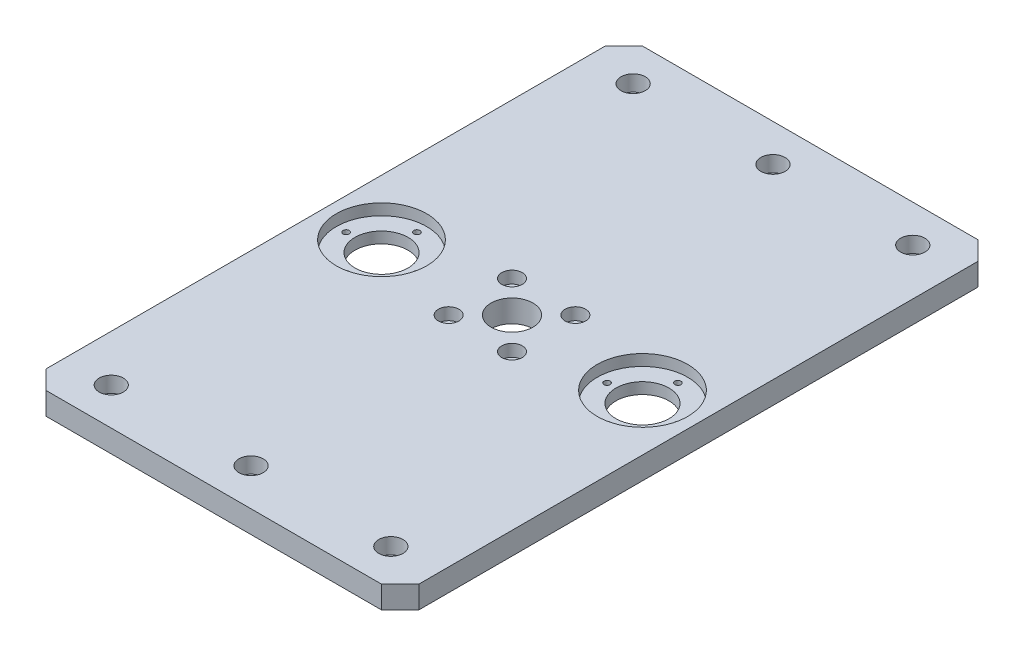
from build123d import *

# Parameters (mm, degrees)
SKETCH_1_W                  = 200
SKETCH_1_H                  = 320
EXTRUDE_1_DEPTH             = 12
HOLE_WIZARD_2_D             = 8.5
HOLE_WIZARD_2_CBORE_D       = 13
HOLE_WIZARD_2_CBORE_DEPTH   = 8.5
CHAMFER_1_SIZE              = 10
SKETCH_4_R                  = 11.25
CUT_EXTRUDE_1_DEPTH         = 190.06083677
HOLE_WIZARD_2_2_D           = 6.5
HOLE_WIZARD_2_2_CBORE_D     = 11
HOLE_WIZARD_2_2_CBORE_DEPTH = 6.5
SKETCH_7_R                  = 24.25
CUT_EXTRUDE_2_DEPTH         = 6
SKETCH_8_R                  = 14.25
CUT_EXTRUDE_3_DEPTH         = 189.774998345
HOLE_WIZARD_M4_1_D          = 3.3


with BuildPart() as part:
    # 草图1 → 凸台-拉伸1 (new body)
    with BuildSketch(Plane(origin=(0, 0, 0), x_dir=(1, 0, 0), z_dir=(0, 1, 0))):
        Rectangle(SKETCH_1_W, SKETCH_1_H)
    extrude(amount=EXTRUDE_1_DEPTH)

    # Hole Wizard 2 (through all)
    with Locations(Plane(origin=(0, 12, 0), x_dir=(1, 0, 0), z_dir=(0, 1, 0))):
        with Locations((-75, 140), (75, 140), (75, -140), (-75, -140), (0, 140), (0, -140)):
            CounterBoreHole(HOLE_WIZARD_2_D / 2, HOLE_WIZARD_2_CBORE_D / 2, HOLE_WIZARD_2_CBORE_DEPTH)

    # 倒角1
    chamfer_1_edges = [part.edges().sort_by_distance(p)[0] for p in [
        (100, 6, 160),
        (-100, 6, 160),
        (-100, 6, -160),
        (100, 6, -160),
    ]]
    chamfer(chamfer_1_edges, length=CHAMFER_1_SIZE)

    # 草图4 → 切除-拉伸1 (cut, through all)
    with BuildSketch(Plane(origin=(0, 0, 0), x_dir=(-1, 0, 0), z_dir=(0, -1, 0))):
        with Locations(Location((0, 0, 0), (0, 0, 90))):
            Circle(SKETCH_4_R)
    extrude(amount=-CUT_EXTRUDE_1_DEPTH, mode=Mode.SUBTRACT)

    # Hole Wizard 2 2 (through all)
    with Locations(Plane(origin=(0, 12, 0), x_dir=(1, 0, 0), z_dir=(0, 1, 0))):
        with Locations((-17, 17), (-17, -17), (17, -17), (17, 17)):
            CounterBoreHole(HOLE_WIZARD_2_2_D / 2, HOLE_WIZARD_2_2_CBORE_D / 2, HOLE_WIZARD_2_2_CBORE_DEPTH)

    # 草图7 → 切除-拉伸2 (cut)
    with BuildSketch(Plane(origin=(0, 12, 0), x_dir=(1, 0, 0), z_dir=(0, 1, 0))):
        with Locations(Location((-70, 0, 0), (0, 0, 270))):
            Circle(SKETCH_7_R)
        with Locations(Location((70, 0, 0), (0, 0, 90))):
            Circle(SKETCH_7_R)
    extrude(amount=-CUT_EXTRUDE_2_DEPTH, mode=Mode.SUBTRACT)

    # 草图8 → 切除-拉伸3 (cut, through all)
    with BuildSketch(Plane(origin=(0, 6, 0), x_dir=(1, 0, 0), z_dir=(0, 1, 0))):
        with Locations(Location((-70, 0, 0), (0, 0, 270))):
            Circle(SKETCH_8_R)
        with Locations(Location((70, 0, 0), (0, 0, 90))):
            Circle(SKETCH_8_R)
    extrude(amount=-CUT_EXTRUDE_3_DEPTH, mode=Mode.SUBTRACT)

    # M4 螺纹孔1 (through all)
    with Locations(Plane(origin=(0, 12, 0), x_dir=(1, 0, 0), z_dir=(0, 1, 0))):
        with Locations((-70, 19), (-89, 0), (-70, -19), (-51, 0), (51, 0), (70, -19), (89, 0), (70, 19)):
            Hole(HOLE_WIZARD_M4_1_D / 2)


solid = part.part
